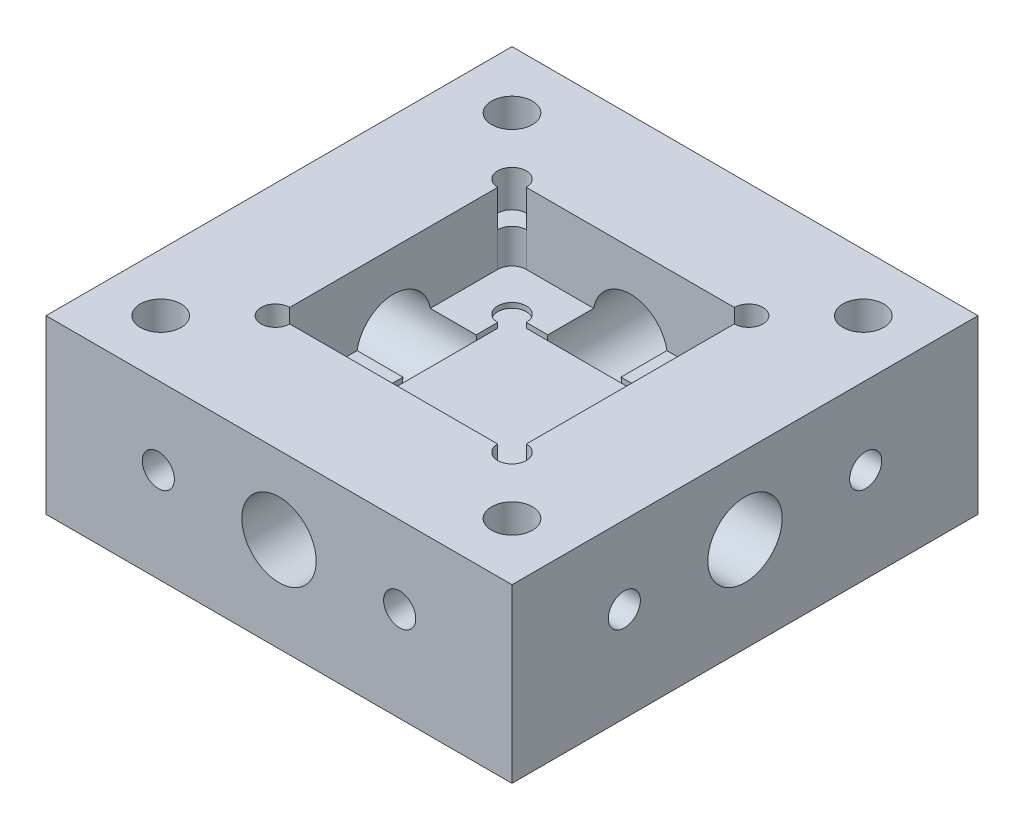
from build123d import *

# Parameters (mm, degrees)
SKETCH1_W             = 25.8
SKETCH1_H             = 25.8
BOSS_EXTRUDE1_DEPTH   = 9.525
SKETCH3_R             = 2.0574
CUT_EXTRUDE3_DEPTH    = 8.89
SKETCH7_R             = 2.0574
CUT_EXTRUDE5_DEPTH    = 8.89
CUT_EXTRUDE10_DEPTH   = 3.9376
CUT_EXTRUDE11_DEPTH   = 0.28
F_4_40_TAPPED_HOLE2_D = 2.2606
SKETCH25_R            = 0.79375
CUT_EXTRUDE12_DEPTH   = 2.032


with BuildPart() as part:
    # Sketch1 → Boss-Extrude1 (new body)
    with BuildSketch(Plane(origin=(0, 0, 0), x_dir=(1, 0, 0), z_dir=(0, 1, 0))):
        Rectangle(SKETCH1_W, SKETCH1_H)
    extrude(amount=BOSS_EXTRUDE1_DEPTH)

    # Sketch3 → Cut-Extrude3 (cut)
    with BuildSketch(Plane.ZY.offset(12.9)):
        with Locations((0, 5.2324)):
            Circle(SKETCH3_R)
    cut_extrude3 = extrude(amount=-CUT_EXTRUDE3_DEPTH, mode=Mode.SUBTRACT)

    # Mirror1: Cut-Extrude3 across plane
    add(cut_extrude3.mirror(Plane(origin=(0, 0, 0), x_dir=(0, 0, 1), z_dir=(1, 0, 0))), mode=Mode.SUBTRACT)

    # Sketch7 → Cut-Extrude5 (cut)
    with BuildSketch(Plane(origin=(0, 0, -12.9), x_dir=(-1, 0, 0), z_dir=(0, 0, -1))):
        with Locations((0, 5.2324)):
            Circle(SKETCH7_R)
    cut_extrude5 = extrude(amount=-CUT_EXTRUDE5_DEPTH, mode=Mode.SUBTRACT)

    # Mirror2: Cut-Extrude5 across plane
    add(cut_extrude5.mirror(Plane.XY), mode=Mode.SUBTRACT)

    # Sketch14 → Cut-Extrude10 (cut)
    with BuildSketch(Plane(origin=(0, 9.525, 0), x_dir=(1, 0, 0), z_dir=(0, 1, 0))):
        with BuildLine():
            Line((-5.75625, -6.55), (5.75625, -6.55))
            ThreePointArc((5.75625, -6.55), (6.317516008, -6.317516008), (6.55, -5.75625))
            Line((6.55, -5.75625), (6.55, 5.75625))
            ThreePointArc((6.55, 5.75625), (6.317516008, 6.317516008), (5.75625, 6.55))
            Line((5.75625, 6.55), (-5.75625, 6.55))
            ThreePointArc((-5.75625, 6.55), (-6.317516008, 6.317516008), (-6.55, 5.75625))
            Line((-6.55, 5.75625), (-6.55, -5.75625))
            ThreePointArc((-6.55, -5.75625), (-6.317516008, -6.317516008), (-5.75625, -6.55))
        make_face()
    extrude(amount=-CUT_EXTRUDE10_DEPTH, mode=Mode.SUBTRACT)

    # Sketch15 → Cut-Extrude11 (cut)
    with BuildSketch(Plane(origin=(0, 5.5874, 0), x_dir=(1, 0, 0), z_dir=(0, 1, 0))):
        with BuildLine():
            Line((-3.21625, -4.01), (3.21625, -4.01))
            ThreePointArc((3.21625, -4.01), (4.571266008, -4.571266008), (4.01, -3.21625))
            Line((4.01, -3.21625), (4.01, 3.21625))
            ThreePointArc((4.01, 3.21625), (4.571266008, 4.571266008), (3.21625, 4.01))
            Line((3.21625, 4.01), (-3.21625, 4.01))
            ThreePointArc((-3.21625, 4.01), (-4.571266008, 4.571266008), (-4.01, 3.21625))
            Line((-4.01, 3.21625), (-4.01, -3.21625))
            ThreePointArc((-4.01, -3.21625), (-4.571266008, -4.571266008), (-3.21625, -4.01))
        make_face()
    extrude(amount=-CUT_EXTRUDE11_DEPTH, mode=Mode.SUBTRACT)

    # #4-40 Tapped Hole2 (through all)
    with Locations(Plane(origin=(0, 9.525, 0), x_dir=(1, 0, 0), z_dir=(0, 1, 0))):
        with Locations((9.725, -9.725), (-9.725, -9.725), (-9.725, 9.725), (9.725, 9.725)):
            Hole(F_4_40_TAPPED_HOLE2_D / 2)

    # Sketch22 → #2-56 Tapped Hole1 (revolve, cut)
    with BuildSketch(Plane(origin=(-6.6802, 5.2324, -12.9), x_dir=(0, 1, 0), z_dir=(1, 0, 0))):
        Polygon((0, 0), (0, 5.36016509), (0.889, 4.826), (0.889, 0), align=None)
    f_2_56_tapped_hole1 = revolve(axis=Axis((-6.6802, 5.2324, -19.25), (0, 0, 1)), mode=Mode.SUBTRACT)

    # Mirror7: #2-56 Tapped Hole1 across plane
    add(f_2_56_tapped_hole1.mirror(Plane(origin=(0, 0, 0), x_dir=(0, 0, 1), z_dir=(1, 0, 0))), mode=Mode.SUBTRACT)

    # Mirror8: #2-56 Tapped Hole1 across plane
    add(f_2_56_tapped_hole1.mirror(Plane.XY), mode=Mode.SUBTRACT)

    # Mirror8 copy 1 sketch → Mirror8 copy 1 (revolve, cut)
    with BuildSketch(Plane(origin=(6.6802, 5.2324, 12.9), x_dir=(0, 1, 0), z_dir=(-1, 0, 0))):
        Polygon((0, 0), (0, 5.36016509), (0.889, 4.826), (0.889, 0), align=None)
    revolve(axis=Axis((6.6802, 5.2324, 19.25), (0, 0, -1)), mode=Mode.SUBTRACT)

    # Sketch24 → #2-56 Tapped Hole2 (revolve, cut)
    with BuildSketch(Plane(origin=(12.9, 5.2324, -6.6802), x_dir=(0, 0, -1), z_dir=(0, 1, 0))):
        Polygon((0, 0), (0, 5.36016509), (0.889, 4.826), (0.889, 0), align=None)
    f_2_56_tapped_hole2 = revolve(axis=Axis((19.25, 5.2324, -6.6802), (-1, 0, 0)), mode=Mode.SUBTRACT)

    # Mirror9: #2-56 Tapped Hole2 across plane
    add(f_2_56_tapped_hole2.mirror(Plane.XY), mode=Mode.SUBTRACT)

    # Mirror10: #2-56 Tapped Hole2 across plane
    add(f_2_56_tapped_hole2.mirror(Plane(origin=(0, 0, 0), x_dir=(0, 0, 1), z_dir=(1, 0, 0))), mode=Mode.SUBTRACT)

    # Mirror10 copy 1 sketch → Mirror10 copy 1 (revolve, cut)
    with BuildSketch(Plane(origin=(-12.9, 5.2324, 6.6802), x_dir=(0, 0, 1), z_dir=(0, 1, 0))):
        Polygon((0, 0), (0, 5.36016509), (0.889, 4.826), (0.889, 0), align=None)
    revolve(axis=Axis((-19.25, 5.2324, 6.6802), (1, 0, 0)), mode=Mode.SUBTRACT)

    # Sketch25 → Cut-Extrude12 (cut)
    with BuildSketch(Plane(origin=(0, 9.525, 0), x_dir=(1, 0, 0), z_dir=(0, 1, 0))):
        with Locations((-6.549999981, 6.549999981)):
            Circle(SKETCH25_R)
        with Locations((6.549999981, 6.549999981)):
            Circle(SKETCH25_R)
        with Locations((6.549999981, -6.549999981)):
            Circle(SKETCH25_R)
        with Locations((-6.549999981, -6.549999981)):
            Circle(SKETCH25_R)
    extrude(amount=-CUT_EXTRUDE12_DEPTH, mode=Mode.SUBTRACT)


solid = part.part
